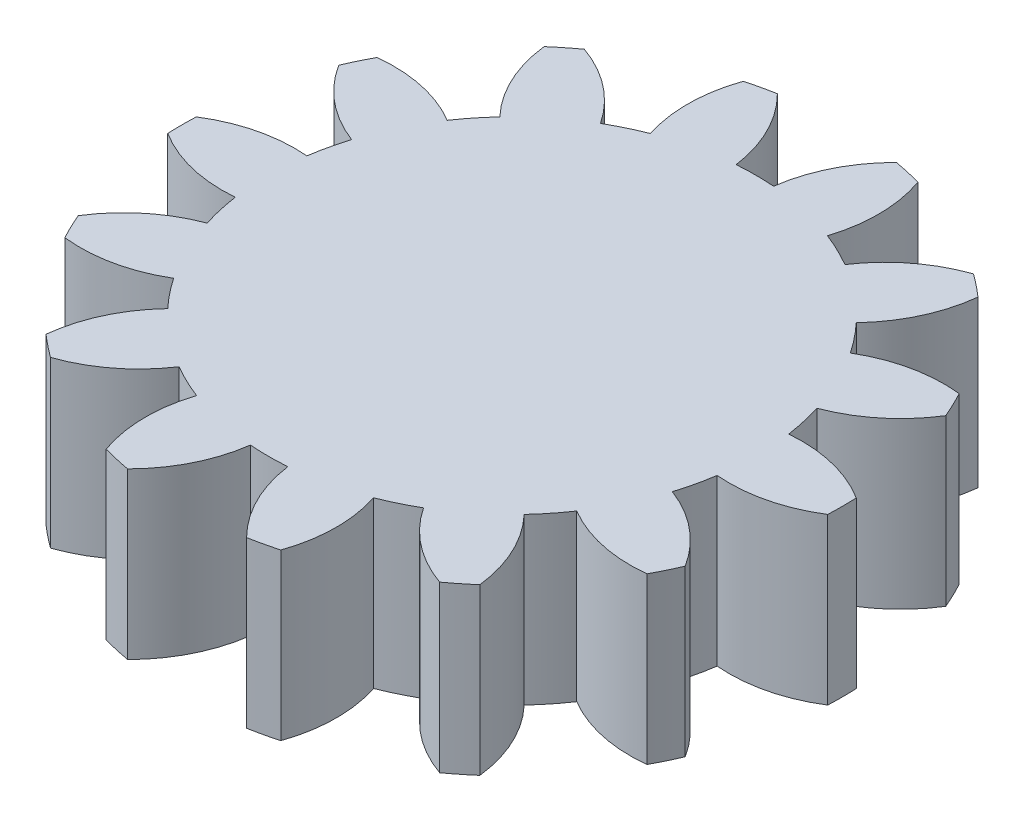
from build123d import *

# Parameters (mm, degrees)
SKETCH_1_R               = 20
EXTRUDE_1_DEPTH          = 10
CUT_EXTRUDE_1_DEPTH      = 31
PATTERN_CIRCULAR_1_COUNT = 14


with BuildPart() as part:
    # 草图1 → 凸台-拉伸1 (new body)
    with BuildSketch(Plane(origin=(0, 0, 0), x_dir=(1, 0, 0), z_dir=(0, 1, 0))):
        with Locations(Location((0, 0, 0), (0, 0, 270))):
            Circle(SKETCH_1_R)
    extrude(amount=EXTRUDE_1_DEPTH)

    # 草图2 → 切除-拉伸1 (cut, symmetric)
    with BuildSketch(Plane(origin=(0, 10, 0), x_dir=(1, 0, 0), z_dir=(0, 1, 0))):
        with BuildLine():
            ThreePointArc((-1.13256244, 14.706454444), (0, 14.75), (1.13256244, 14.706454444))
            ThreePointArc((1.13256244, 14.706454444), (1.960472225, 17.392163769), (3.60273366, 19.672831778))
            ThreePointArc((3.60273366, 19.672831778), (0, 20), (-3.60273366, 19.672831778))
            ThreePointArc((-3.60273366, 19.672831778), (-1.960472225, 17.392163769), (-1.13256244, 14.706454444))
        make_face()
    cut_extrude_1 = extrude(amount=CUT_EXTRUDE_1_DEPTH, both=True, mode=Mode.SUBTRACT)

    # 阵列(圆周)1: 切除-拉伸1 ×14 about axis
    pattern_circular_1_axis = Axis((0, 0, 0), (0, 1, 0))
    for i in range(1, PATTERN_CIRCULAR_1_COUNT):
        add(cut_extrude_1.rotate(pattern_circular_1_axis, i * 360 / PATTERN_CIRCULAR_1_COUNT), mode=Mode.SUBTRACT)


solid = part.part
